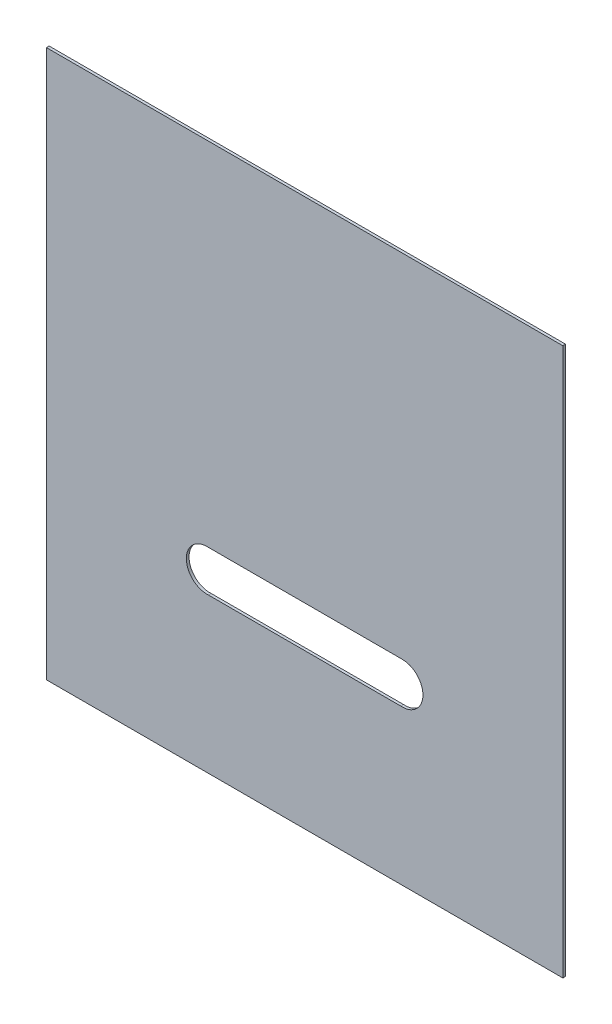
from build123d import *

# Parameters (mm, degrees)
SKETCH1_W           = 382
SKETCH1_H           = 405
BOSS_EXTRUDE1_DEPTH = 2
CUT_EXTRUDE2_DEPTH  = 296.144032635


with BuildPart() as part:
    # Sketch1 → Boss-Extrude1 (new body)
    with BuildSketch(Plane(origin=(0, 0, 0), x_dir=(-1, 0, 0), z_dir=(0, 0, -1))):
        with Locations((0, 22.5)):
            Rectangle(SKETCH1_W, SKETCH1_H)
    extrude(amount=-BOSS_EXTRUDE1_DEPTH)

    # Sketch4 → Cut-Extrude2 (cut, through all)
    with BuildSketch(Plane.XY.offset(2)):
        with BuildLine():
            Line((72.225, -35.25), (-72.225, -35.25))
            ThreePointArc((-72.225, -35.25), (-87.484996723, -51.072630075), (-71.120463898, -65.75))
            Line((-71.120463898, -65.75), (71.120463898, -65.75))
            ThreePointArc((71.120463898, -65.75), (87.484996723, -51.072630075), (72.225, -35.25))
        make_face()
    extrude(amount=-CUT_EXTRUDE2_DEPTH, mode=Mode.SUBTRACT)


solid = part.part
